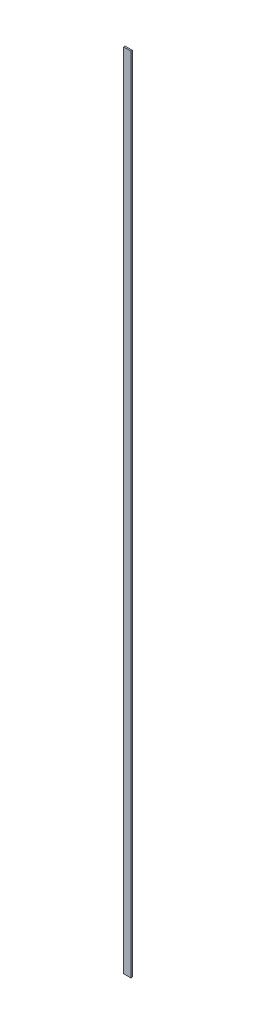
from build123d import *

# Parameters (mm, degrees)
SKETCH_1_W      = 50
SKETCH_1_H      = 10
EXTRUDE_1_DEPTH = 5500


with BuildPart() as part:
    # Эскиз1 → Бобышка-Вытянуть1 (new body)
    with BuildSketch(Plane(origin=(0, 0, 0), x_dir=(1, 0, 0), z_dir=(0, 1, 0))):
        Rectangle(SKETCH_1_W, SKETCH_1_H)
    extrude(amount=EXTRUDE_1_DEPTH)


solid = part.part
